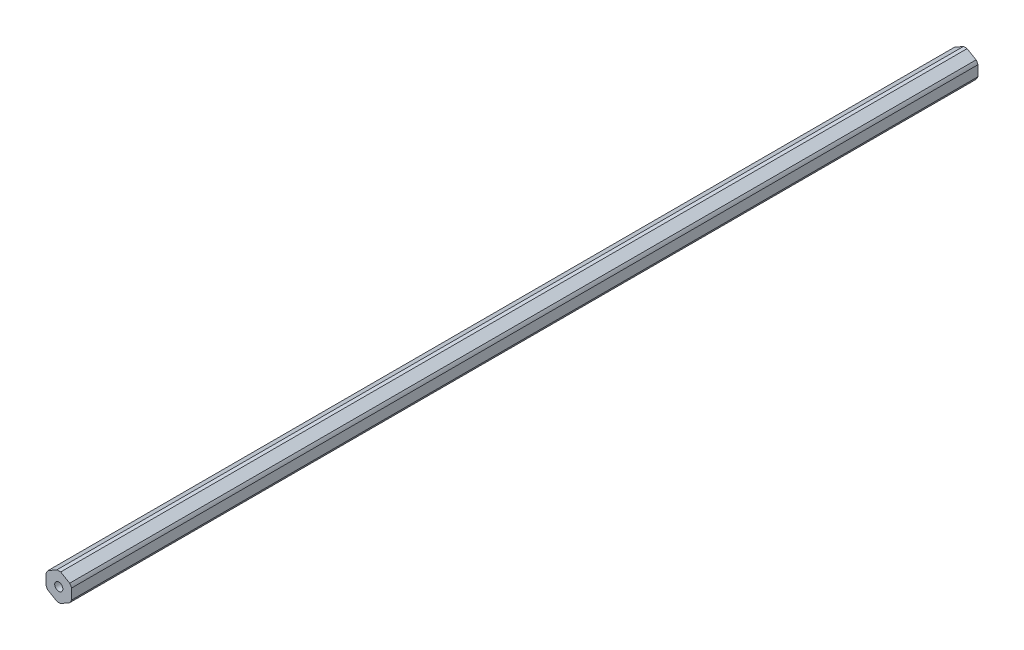
from build123d import *

# Parameters (mm, degrees)
BOSS_EXTRUDE1_DEPTH                  = 225.425
F_10_32_TAPPED_HOLE1_D               = 4.0386
F_10_32_TAPPED_HOLE1_DEPTH           = 15.07744
F_10_32_TAPPED_HOLE1_TIP             = 1.213317848
F_10_32_TAPPED_HOLE1_ON_FACE_2_D     = 4.0386
F_10_32_TAPPED_HOLE1_ON_FACE_2_DEPTH = 15.07744
F_10_32_TAPPED_HOLE1_ON_FACE_2_TIP   = 1.213317848


with BuildPart() as part:
    # Sketch1 → Boss-Extrude1 (new, symmetric)
    with BuildSketch(Plane.XY):
        with BuildLine():
            ThreePointArc((6.35, 2.590301913), (5.939202219, 3.429), (5.41826726, 4.204110358))
            Line((5.41826726, 4.204110358), (0.93173274, 6.79441227))
            ThreePointArc((0.93173274, 6.79441227), (0, 6.858), (-0.93173274, 6.79441227))
            Line((-0.93173274, 6.79441227), (-5.41826726, 4.204110358))
            ThreePointArc((-5.41826726, 4.204110358), (-5.939202219, 3.429), (-6.35, 2.590301913))
            Line((-6.35, 2.590301913), (-6.35, -2.590301913))
            ThreePointArc((-6.35, -2.590301913), (-5.939202219, -3.429), (-5.41826726, -4.204110358))
            Line((-5.41826726, -4.204110358), (-0.93173274, -6.79441227))
            ThreePointArc((-0.93173274, -6.79441227), (0, -6.858), (0.93173274, -6.79441227))
            Line((0.93173274, -6.79441227), (5.41826726, -4.204110358))
            ThreePointArc((5.41826726, -4.204110358), (5.939202219, -3.429), (6.35, -2.590301913))
            Line((6.35, -2.590301913), (6.35, 2.590301913))
        make_face()
    extrude(amount=BOSS_EXTRUDE1_DEPTH, both=True)

    # #10-32 Tapped Hole1
    with Locations(Plane.XY.offset(225.425)):
        with Locations((0, 0)):
            Hole(F_10_32_TAPPED_HOLE1_D / 2, depth=F_10_32_TAPPED_HOLE1_DEPTH)
            with Locations((0, 0, -(F_10_32_TAPPED_HOLE1_DEPTH + F_10_32_TAPPED_HOLE1_TIP / 2))):  # 118° drill point
                Cone(0, F_10_32_TAPPED_HOLE1_D / 2, F_10_32_TAPPED_HOLE1_TIP, mode=Mode.SUBTRACT)

    # #10-32 Tapped Hole1 on face 2
    with Locations(Plane(origin=(0, 0, -225.425), x_dir=(-1, 0, 0), z_dir=(0, 0, -1))):
        with Locations((0, 0)):
            Hole(F_10_32_TAPPED_HOLE1_ON_FACE_2_D / 2, depth=F_10_32_TAPPED_HOLE1_ON_FACE_2_DEPTH)
            with Locations((0, 0, -(F_10_32_TAPPED_HOLE1_ON_FACE_2_DEPTH + F_10_32_TAPPED_HOLE1_ON_FACE_2_TIP / 2))):  # 118° drill point
                Cone(0, F_10_32_TAPPED_HOLE1_ON_FACE_2_D / 2, F_10_32_TAPPED_HOLE1_ON_FACE_2_TIP, mode=Mode.SUBTRACT)


solid = part.part
